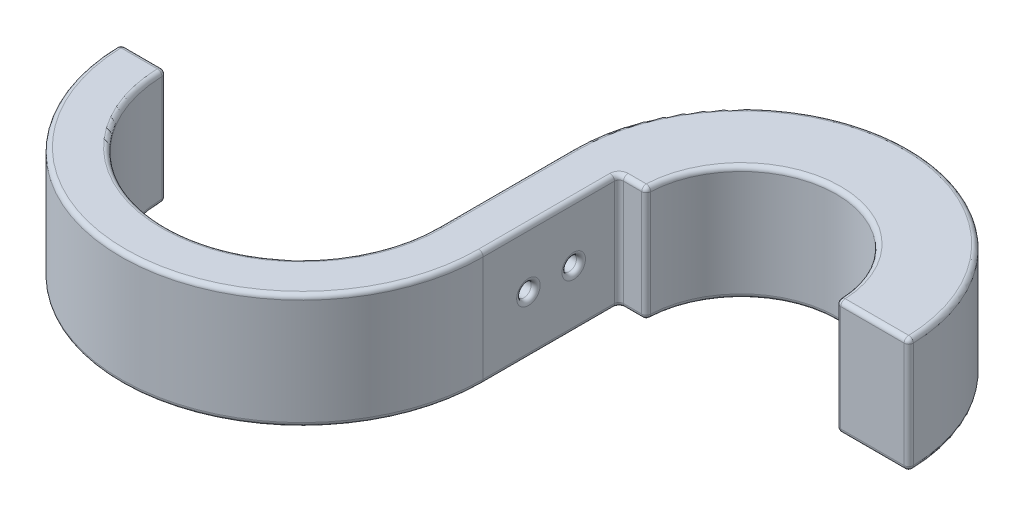
from build123d import *

# Parameters (mm, degrees)
BOSS_EXTRUDE1_DEPTH = 25.4
SKETCH3_R           = 1.6
CUT_EXTRUDE2_DEPTH  = 110.293915659
FILLET1_R           = 1


with BuildPart() as part:
    # Sketch1 → Boss-Extrude1 (new body)
    with BuildSketch(Plane(origin=(0, 0, 0), x_dir=(1, 0, 0), z_dir=(0, 1, 0))):
        with BuildLine():
            Line((42, 0), (58, 0))
            ThreePointArc((58, 0), (21, 37), (-16, 0))
            Line((-16, 0), (-16, -30))
            ThreePointArc((-16, -30), (-46, -60), (-76, -30))
            Line((-76, -30), (-86, -30))
            ThreePointArc((-86, -30), (-46, -70), (-6, -30))
            Line((-6, -30), (-6, 0))
            Line((-6, 0), (0, 0))
            ThreePointArc((0, 0), (21, 21), (42, 0))
        make_face()
    extrude(amount=BOSS_EXTRUDE1_DEPTH)

    # Sketch3 → Cut-Extrude2 (cut, through all)
    with BuildSketch(Plane(origin=(-6, 0, 0), x_dir=(0, 0, -1), z_dir=(1, 0, 0))):
        with Locations((-20, 12.7)):
            Circle(SKETCH3_R)
        with Locations((-10, 12.7)):
            Circle(SKETCH3_R)
    extrude(amount=-CUT_EXTRUDE2_DEPTH, mode=Mode.SUBTRACT)

    # Fillet1
    fillet1_edges = [part.edges().sort_by_distance(p)[0] for p in [
        (-46, 25.4, 70),
        (-46, 0, 60),
        (-81, 0, 30),
        (-46, 0, 70),
        (-6, 0, 15),
        (-3, 0, 0),
        (-81, 25.4, 30),
        (0, 12.7, 0),
        (42, 12.7, 0),
        (58, 12.7, 0),
        (-76, 12.7, 30),
        (-86, 12.7, 30),
        (-6, 12.7, 0),
        (-46, 25.4, 60),
        (-16, 25.4, 15),
        (21, 25.4, -37),
        (50, 25.4, 0),
        (-16, 12.7, 21.6),
        (-6, 12.7, 21.6),
        (21, 25.4, -21),
        (-16, 12.7, 11.6),
        (-6, 12.7, 11.6),
        (-3, 25.4, 0),
        (-6, 25.4, 15),
        (21, 0, -21),
        (50, 0, 0),
        (21, 0, -37),
        (-16, 0, 15),
    ]]
    fillet(fillet1_edges, radius=FILLET1_R)


solid = part.part
